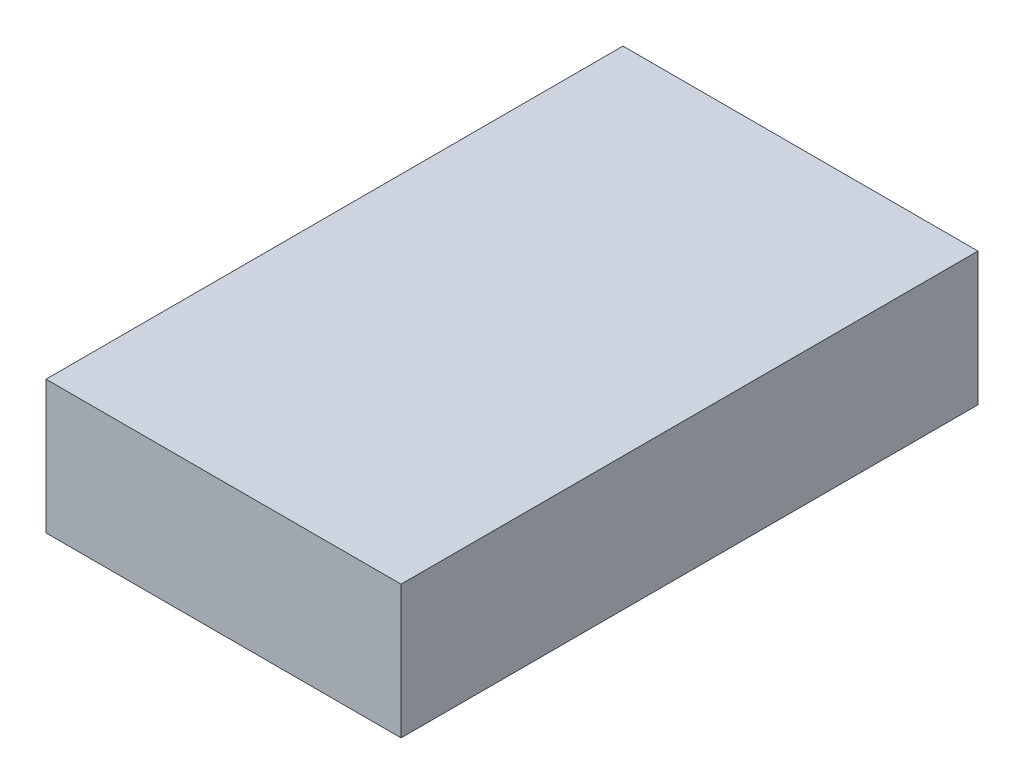
from build123d import *

# Parameters (mm, degrees)
EXTRUDE1_DEPTH      = 25.4
EXTRUDE1_DEPTH_BACK = 304.8
SKETCH1_W           = 203.2
SKETCH1_H           = 76.2


with BuildPart() as part:
    # Sketch1 → Extrude1 (new, two sides: drawn at the far end of the back side and taken through both)
    with BuildSketch(Plane.XY.offset(-203.2).offset(-EXTRUDE1_DEPTH_BACK)):
        with Locations((304.8, 0)):
            Rectangle(SKETCH1_W, SKETCH1_H)
    extrude(amount=EXTRUDE1_DEPTH + EXTRUDE1_DEPTH_BACK)


solid = part.part
